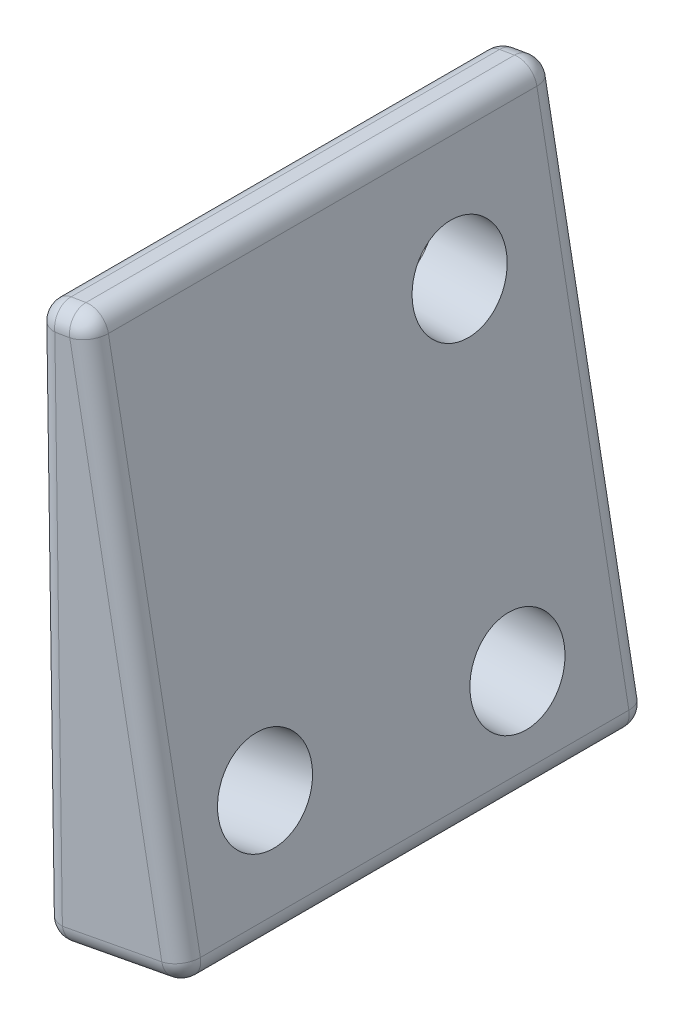
from build123d import *

# Parameters (mm, degrees)
BOSS_EXTRUDE1_DEPTH = 9.525
SKETCH6_R           = 1.905
CUT_EXTRUDE2_DEPTH  = 25.46325319
SKETCH7_R           = 1.905
CUT_EXTRUDE3_DEPTH  = 25.464227008
FILLET1_R           = 0.79375


with BuildPart() as part:
    # Sketch1 → Boss-Extrude1 (new, symmetric)
    with BuildSketch(Plane.XY):
        Polygon((-5.755049727, -1.093010514), (-6.085429683, 21.348472195), (-4.035272706, 21.696550963), (0, 0), align=None)
    extrude(amount=BOSS_EXTRUDE1_DEPTH, both=True)

    # Sketch6 → Cut-Extrude2 (cut, through all)
    with BuildSketch(Plane(origin=(-5.769890331, -0.084943412, 0), x_dir=(0, 0, 1), z_dir=(-0.9998916512998705, -0.014720246628988168, 0))):
        with Locations(Location((-4.7625, 3.863780902, 0), (0, 0, 270))):
            Circle(SKETCH6_R)
        with Locations(Location((-4.7625, 16.563780902, 0), (0, 0, 270))):
            Circle(SKETCH6_R)
    extrude(amount=-CUT_EXTRUDE2_DEPTH, mode=Mode.SUBTRACT)

    # Sketch7 → Cut-Extrude3 (cut, through all)
    with BuildSketch(Plane(origin=(0, 0, 0), x_dir=(0, 0, -1), z_dir=(0.9831405992384419, 0.18285120215376635, 0))):
        with Locations(Location((-5.378603812, 4.71861458, 0), (0, 0, 90))):
            Circle(SKETCH7_R)
    extrude(amount=-CUT_EXTRUDE3_DEPTH, mode=Mode.SUBTRACT)

    # Fillet1
    fillet1_edges = [part.edges().sort_by_distance(p)[0] for p in [
        (-5.060351194, 21.522511579, 9.525),
        (-5.920239705, 10.12773084, 9.525),
        (-2.877524863, -0.546505257, 9.525),
        (-5.920239705, 10.12773084, -9.525),
        (-5.060351194, 21.522511579, -9.525),
        (-2.017636353, 10.848275481, -9.525),
        (-2.877524863, -0.546505257, -9.525),
        (-5.755049727, -1.093010514, 0),
        (-6.085429683, 21.348472195, 0),
        (-4.035272706, 21.696550963, 0),
        (0, 0, 0),
        (-2.017636353, 10.848275481, 9.525),
    ]]
    fillet(fillet1_edges, radius=FILLET1_R)


solid = part.part
